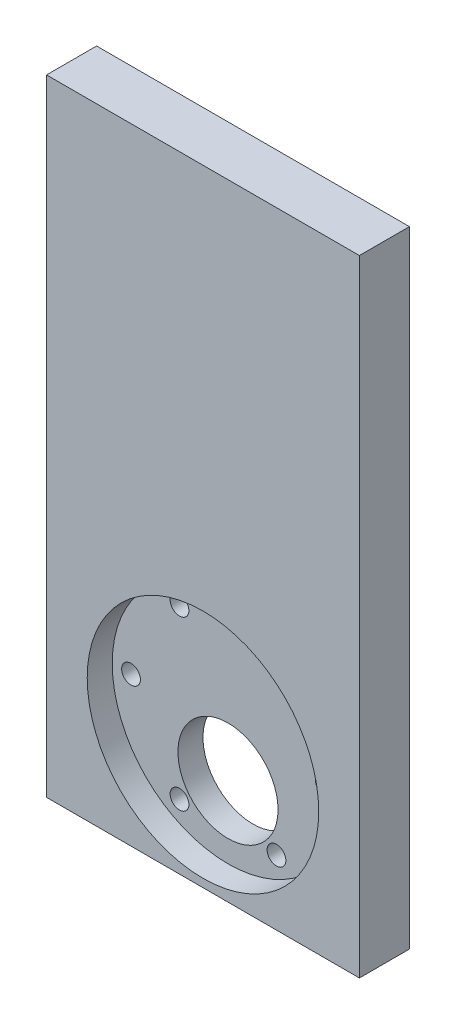
from build123d import *

# Parameters (mm, degrees)
SKETCH3_W           = 50
SKETCH3_H           = 100
BOSS_EXTRUDE1_DEPTH = 8
SKETCH3_3_R         = 8
SKETCH3_3_R_2       = 1.5
CUT_EXTRUDE2_DEPTH  = 10
SKETCH4_R           = 18.5
CUT_EXTRUDE3_DEPTH  = 4


with BuildPart() as part:
    # Sketch3 → Boss-Extrude1 (new body)
    with BuildSketch(Plane.XY):
        with Locations((0, 50)):
            Rectangle(SKETCH3_W, SKETCH3_H)
    extrude(amount=BOSS_EXTRUDE1_DEPTH)

    # Sketch3<3> → Cut-Extrude2 (cut)
    with BuildSketch(Plane.XY):
        with Locations((0, 12.8)):
            Circle(SKETCH3_3_R)
        with Locations((-7.75, 33.223393759)):
            Circle(SKETCH3_3_R_2)
        with Locations((7.75, 33.223393759)):
            Circle(SKETCH3_3_R_2)
        with Locations((-15.5, 19.8)):
            Circle(SKETCH3_3_R_2)
        with Locations((-7.75, 6.376606241)):
            Circle(SKETCH3_3_R_2)
        with Locations((7.75, 6.376606241)):
            Circle(SKETCH3_3_R_2)
        with Locations((15.5, 19.8)):
            Circle(SKETCH3_3_R_2)
    extrude(amount=CUT_EXTRUDE2_DEPTH, mode=Mode.SUBTRACT)

    # Sketch4 → Cut-Extrude3 (cut)
    with BuildSketch(Plane.XY.offset(8)):
        with Locations((0, 19.8)):
            Circle(SKETCH4_R)
    extrude(amount=-CUT_EXTRUDE3_DEPTH, mode=Mode.SUBTRACT)


solid = part.part
